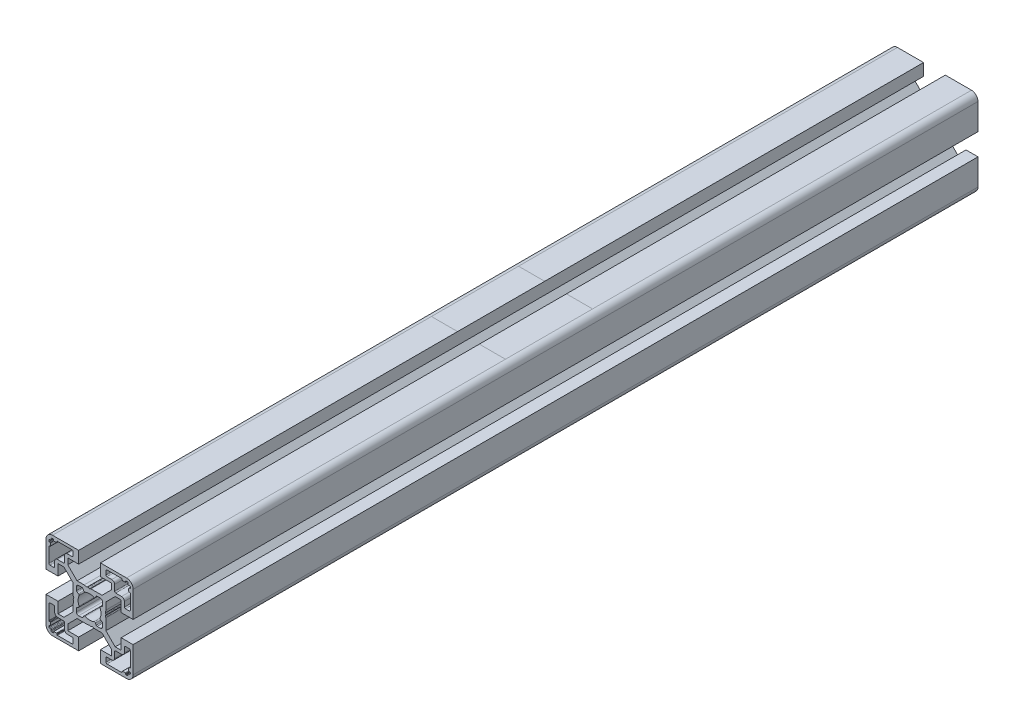
from build123d import *

# Parameters (mm, degrees)
BOSS_EXTRU_1_DEPTH = 388


with BuildPart() as part:
    # Esquisse1 → Boss.-Extru.1 (new body)
    with BuildSketch(Plane.XY.offset(50)):
        with BuildLine():
            Line((-12.564461466, 27.123082583), (-12.564461466, 15.123082583))
            Line((-12.564461466, 15.123082583), (-7.064461466, 15.123082583))
            Line((-7.064461466, 15.123082583), (-7.064461466, 20.123082583))
            Line((-7.064461466, 20.123082583), (-4.332228419, 20.123082583))
            Line((-4.332228419, 20.123082583), (-0.064461466, 15.85531563))
            Line((-0.064461466, 15.85531563), (-0.064461466, 10.776672421))
            ThreePointArc((-0.064461466, 10.776672421), (-0.047424379, 10.647262899), (0.002525832, 10.526672421))
            Line((0.002525832, 10.526672421), (0.235538534, 10.123082583))
            Line((0.235538534, 10.123082583), (0.002525832, 9.719492744))
            ThreePointArc((0.002525832, 9.719492744), (-0.064461466, 9.469492744), (0.002525832, 9.219492744))
            Line((0.002525832, 9.219492744), (0.184561942, 8.904196954))
            Line((0.184561942, 8.904196954), (-0.064461466, 7.623082583))
            Line((-0.064461466, 7.623082583), (-0.064461466, 4.390849536))
            Line((-0.064461466, 4.390849536), (-4.332228419, 0.123082583))
            Line((-4.332228419, 0.123082583), (-7.064461466, 0.123082583))
            Line((-7.064461466, 0.123082583), (-7.064461466, 5.123082583))
            Line((-7.064461466, 5.123082583), (-12.564461466, 5.123082583))
            Line((-12.564461466, 5.123082583), (-12.564461466, -6.876917417))
            ThreePointArc((-12.564461466, -6.876917417), (-11.685781809, -8.998237761), (-9.564461466, -9.876917417))
            Line((-9.564461466, -9.876917417), (2.435538534, -9.876917417))
            Line((2.435538534, -9.876917417), (2.435538534, -4.376917417))
            Line((2.435538534, -4.376917417), (-2.564461466, -4.376917417))
            Line((-2.564461466, -4.376917417), (-2.564461466, -1.64468437))
            Line((-2.564461466, -1.64468437), (1.703305487, 2.623082583))
            Line((1.703305487, 2.623082583), (6.781948696, 2.623082583))
            ThreePointArc((6.781948696, 2.623082583), (6.911358218, 2.640119669), (7.031948696, 2.690069881))
            Line((7.031948696, 2.690069881), (7.435538534, 2.923082583))
            Line((7.435538534, 2.923082583), (7.839128373, 2.690069881))
            ThreePointArc((7.839128373, 2.690069881), (8.089128373, 2.623082583), (8.339128373, 2.690069881))
            Line((8.339128373, 2.690069881), (8.654424163, 2.87210599))
            Line((8.654424163, 2.87210599), (9.935538534, 2.623082583))
            Line((9.935538534, 2.623082583), (13.167771581, 2.623082583))
            Line((13.167771581, 2.623082583), (17.435538534, -1.64468437))
            Line((17.435538534, -1.64468437), (17.435538534, -4.376917417))
            Line((17.435538534, -4.376917417), (12.435538534, -4.376917417))
            Line((12.435538534, -4.376917417), (12.435538534, -9.876917417))
            Line((12.435538534, -9.876917417), (24.435538534, -9.876917417))
            ThreePointArc((24.435538534, -9.876917417), (26.556858878, -8.998237761), (27.435538534, -6.876917417))
            Line((27.435538534, -6.876917417), (27.435538534, 5.123082583))
            Line((27.435538534, 5.123082583), (21.935538534, 5.123082583))
            Line((21.935538534, 5.123082583), (21.935538534, 0.123082583))
            Line((21.935538534, 0.123082583), (19.203305487, 0.123082583))
            Line((19.203305487, 0.123082583), (14.935538534, 4.390849536))
            Line((14.935538534, 4.390849536), (14.935538534, 9.469492744))
            ThreePointArc((14.935538534, 9.469492744), (14.918501447, 9.598902267), (14.868551236, 9.719492744))
            Line((14.868551236, 9.719492744), (14.635538534, 10.123082583))
            Line((14.635538534, 10.123082583), (14.868551236, 10.526672421))
            ThreePointArc((14.868551236, 10.526672421), (14.935538534, 10.776672421), (14.868551236, 11.026672421))
            Line((14.868551236, 11.026672421), (14.686515127, 11.341968211))
            Line((14.686515127, 11.341968211), (14.935538534, 12.623082583))
            Line((14.935538534, 12.623082583), (14.935538534, 15.85531563))
            Line((14.935538534, 15.85531563), (19.203305487, 20.123082583))
            Line((19.203305487, 20.123082583), (21.935538534, 20.123082583))
            Line((21.935538534, 20.123082583), (21.935538534, 15.123082583))
            Line((21.935538534, 15.123082583), (27.435538534, 15.123082583))
            Line((27.435538534, 15.123082583), (27.435538534, 27.123082583))
            ThreePointArc((27.435538534, 27.123082583), (26.556858878, 29.244402926), (24.435538534, 30.123082583))
            Line((24.435538534, 30.123082583), (12.435538534, 30.123082583))
            Line((12.435538534, 30.123082583), (12.435538534, 24.623082583))
            Line((12.435538534, 24.623082583), (17.435538534, 24.623082583))
            Line((17.435538534, 24.623082583), (17.435538534, 21.890849536))
            Line((17.435538534, 21.890849536), (13.167771581, 17.623082583))
            Line((13.167771581, 17.623082583), (8.089128373, 17.623082583))
            ThreePointArc((8.089128373, 17.623082583), (7.95971885, 17.606045496), (7.839128373, 17.556095285))
            Line((7.839128373, 17.556095285), (7.435538534, 17.323082583))
            Line((7.435538534, 17.323082583), (7.031948696, 17.556095285))
            ThreePointArc((7.031948696, 17.556095285), (6.781948696, 17.623082583), (6.531948696, 17.556095285))
            Line((6.531948696, 17.556095285), (6.216652905, 17.374059175))
            Line((6.216652905, 17.374059175), (4.935538534, 17.623082583))
            Line((4.935538534, 17.623082583), (1.703305487, 17.623082583))
            Line((1.703305487, 17.623082583), (-2.564461466, 21.890849536))
            Line((-2.564461466, 21.890849536), (-2.564461466, 24.623082583))
            Line((-2.564461466, 24.623082583), (2.435538534, 24.623082583))
            Line((2.435538534, 24.623082583), (2.435538534, 30.123082583))
            Line((2.435538534, 30.123082583), (-9.564461466, 30.123082583))
            ThreePointArc((-9.564461466, 30.123082583), (-11.685781809, 29.244402926), (-12.564461466, 27.123082583))
        make_face()
        with BuildLine():
            Line((-11.264461466, -4.676917417), (-11.264461466, 2.123082583))
            ThreePointArc((-11.264461466, 2.123082583), (-11.118014856, 2.476635973), (-10.764461466, 2.623082583))
            Line((-10.764461466, 2.623082583), (-9.064461466, 2.623082583))
            ThreePointArc((-9.064461466, 2.623082583), (-8.710908075, 2.476635973), (-8.564461466, 2.123082583))
            Line((-8.564461466, 2.123082583), (-8.564461466, -0.076917417))
            ThreePointArc((-8.564461466, -0.076917417), (-8.183700281, -0.996156233), (-7.264461466, -1.376917417))
            Line((-7.264461466, -1.376917417), (-4.564461466, -1.376917417))
            ThreePointArc((-4.564461466, -1.376917417), (-4.210908075, -1.523364027), (-4.064461466, -1.876917417))
            Line((-4.064461466, -1.876917417), (-4.064461466, -4.576917417))
            ThreePointArc((-4.064461466, -4.576917417), (-3.683700281, -5.496156233), (-2.764461466, -5.876917417))
            Line((-2.764461466, -5.876917417), (-0.564461466, -5.876917417))
            ThreePointArc((-0.564461466, -5.876917417), (-0.210908075, -6.023364027), (-0.064461466, -6.376917417))
            Line((-0.064461466, -6.376917417), (-0.064461466, -8.076917417))
            ThreePointArc((-0.064461466, -8.076917417), (-0.210908075, -8.430470808), (-0.564461466, -8.576917417))
            Line((-0.564461466, -8.576917417), (-7.364461466, -8.576917417))
            ThreePointArc((-7.364461466, -8.576917417), (-7.505882822, -8.518338774), (-7.564461466, -8.376917417))
            Line((-7.564461466, -8.376917417), (-7.564461466, -8.076917417))
            ThreePointArc((-7.564461466, -8.076917417), (-7.62304011, -7.935496061), (-7.764461466, -7.876917417))
            Line((-7.764461466, -7.876917417), (-8.964461466, -7.876917417))
            ThreePointArc((-8.964461466, -7.876917417), (-9.105882822, -7.935496061), (-9.164461466, -8.076917417))
            Line((-9.164461466, -8.076917417), (-9.164461466, -8.376917417))
            ThreePointArc((-9.164461466, -8.376917417), (-9.22304011, -8.518338774), (-9.364461466, -8.576917417))
            Line((-9.364461466, -8.576917417), (-9.864461466, -8.576917417))
            ThreePointArc((-9.864461466, -8.576917417), (-10.0765935, -8.489049452), (-10.164461466, -8.276917417))
            Line((-10.164461466, -8.276917417), (-10.164461466, -7.776917417))
            ThreePointArc((-10.164461466, -7.776917417), (-10.252329431, -7.564785383), (-10.464461466, -7.476917417))
            Line((-10.464461466, -7.476917417), (-10.964461466, -7.476917417))
            ThreePointArc((-10.964461466, -7.476917417), (-11.1765935, -7.389049452), (-11.264461466, -7.176917417))
            Line((-11.264461466, -7.176917417), (-11.264461466, -6.676917417))
            ThreePointArc((-11.264461466, -6.676917417), (-11.205882822, -6.535496061), (-11.064461466, -6.476917417))
            Line((-11.064461466, -6.476917417), (-10.764461466, -6.476917417))
            ThreePointArc((-10.764461466, -6.476917417), (-10.62304011, -6.418338774), (-10.564461466, -6.276917417))
            Line((-10.564461466, -6.276917417), (-10.564461466, -5.076917417))
            ThreePointArc((-10.564461466, -5.076917417), (-10.62304011, -4.935496061), (-10.764461466, -4.876917417))
            Line((-10.764461466, -4.876917417), (-11.064461466, -4.876917417))
            ThreePointArc((-11.064461466, -4.876917417), (-11.205882822, -4.818338774), (-11.264461466, -4.676917417))
        make_face(mode=Mode.SUBTRACT)
        with BuildLine():
            Line((14.935538534, -8.076917417), (14.935538534, -6.376917417))
            ThreePointArc((14.935538534, -6.376917417), (15.081985144, -6.023364027), (15.435538534, -5.876917417))
            Line((15.435538534, -5.876917417), (17.635538534, -5.876917417))
            ThreePointArc((17.635538534, -5.876917417), (18.55477735, -5.496156233), (18.935538534, -4.576917417))
            Line((18.935538534, -4.576917417), (18.935538534, -1.876917417))
            ThreePointArc((18.935538534, -1.876917417), (19.081985144, -1.523364027), (19.435538534, -1.376917417))
            Line((19.435538534, -1.376917417), (22.135538534, -1.376917417))
            ThreePointArc((22.135538534, -1.376917417), (23.05477735, -0.996156233), (23.435538534, -0.076917417))
            Line((23.435538534, -0.076917417), (23.435538534, 2.123082583))
            ThreePointArc((23.435538534, 2.123082583), (23.581985144, 2.476635973), (23.935538534, 2.623082583))
            Line((23.935538534, 2.623082583), (25.635538534, 2.623082583))
            ThreePointArc((25.635538534, 2.623082583), (25.989091925, 2.476635973), (26.135538534, 2.123082583))
            Line((26.135538534, 2.123082583), (26.135538534, -4.676917417))
            ThreePointArc((26.135538534, -4.676917417), (26.07695989, -4.818338774), (25.935538534, -4.876917417))
            Line((25.935538534, -4.876917417), (25.635538534, -4.876917417))
            ThreePointArc((25.635538534, -4.876917417), (25.494117178, -4.935496061), (25.435538534, -5.076917417))
            Line((25.435538534, -5.076917417), (25.435538534, -6.276917417))
            ThreePointArc((25.435538534, -6.276917417), (25.494117178, -6.418338774), (25.635538534, -6.476917417))
            Line((25.635538534, -6.476917417), (25.935538534, -6.476917417))
            ThreePointArc((25.935538534, -6.476917417), (26.07695989, -6.535496061), (26.135538534, -6.676917417))
            Line((26.135538534, -6.676917417), (26.135538534, -7.176917417))
            ThreePointArc((26.135538534, -7.176917417), (26.047670569, -7.389049452), (25.835538534, -7.476917417))
            Line((25.835538534, -7.476917417), (25.335538534, -7.476917417))
            ThreePointArc((25.335538534, -7.476917417), (25.1234065, -7.564785383), (25.035538534, -7.776917417))
            Line((25.035538534, -7.776917417), (25.035538534, -8.276917417))
            ThreePointArc((25.035538534, -8.276917417), (24.947670569, -8.489049452), (24.735538534, -8.576917417))
            Line((24.735538534, -8.576917417), (24.235538534, -8.576917417))
            ThreePointArc((24.235538534, -8.576917417), (24.094117178, -8.518338774), (24.035538534, -8.376917417))
            Line((24.035538534, -8.376917417), (24.035538534, -8.076917417))
            ThreePointArc((24.035538534, -8.076917417), (23.97695989, -7.935496061), (23.835538534, -7.876917417))
            Line((23.835538534, -7.876917417), (22.635538534, -7.876917417))
            ThreePointArc((22.635538534, -7.876917417), (22.494117178, -7.935496061), (22.435538534, -8.076917417))
            Line((22.435538534, -8.076917417), (22.435538534, -8.376917417))
            ThreePointArc((22.435538534, -8.376917417), (22.37695989, -8.518338774), (22.235538534, -8.576917417))
            Line((22.235538534, -8.576917417), (15.435538534, -8.576917417))
            ThreePointArc((15.435538534, -8.576917417), (15.081985144, -8.430470808), (14.935538534, -8.076917417))
        make_face(mode=Mode.SUBTRACT)
        with BuildLine():
            Line((14.935538534, 26.623082583), (14.935538534, 28.323082583))
            ThreePointArc((14.935538534, 28.323082583), (15.081985144, 28.676635973), (15.435538534, 28.823082583))
            Line((15.435538534, 28.823082583), (22.235538534, 28.823082583))
            ThreePointArc((22.235538534, 28.823082583), (22.37695989, 28.764503939), (22.435538534, 28.623082583))
            Line((22.435538534, 28.623082583), (22.435538534, 28.323082583))
            ThreePointArc((22.435538534, 28.323082583), (22.494117178, 28.181661226), (22.635538534, 28.123082583))
            Line((22.635538534, 28.123082583), (23.835538534, 28.123082583))
            ThreePointArc((23.835538534, 28.123082583), (23.97695989, 28.181661226), (24.035538534, 28.323082583))
            Line((24.035538534, 28.323082583), (24.035538534, 28.623082583))
            ThreePointArc((24.035538534, 28.623082583), (24.094117178, 28.764503939), (24.235538534, 28.823082583))
            Line((24.235538534, 28.823082583), (24.735538534, 28.823082583))
            ThreePointArc((24.735538534, 28.823082583), (24.947670569, 28.735214617), (25.035538534, 28.523082583))
            Line((25.035538534, 28.523082583), (25.035538534, 28.023082583))
            ThreePointArc((25.035538534, 28.023082583), (25.1234065, 27.810950548), (25.335538534, 27.723082583))
            Line((25.335538534, 27.723082583), (25.835538534, 27.723082583))
            ThreePointArc((25.835538534, 27.723082583), (26.047670569, 27.635214617), (26.135538534, 27.423082583))
            Line((26.135538534, 27.423082583), (26.135538534, 26.923082583))
            ThreePointArc((26.135538534, 26.923082583), (26.07695989, 26.781661226), (25.935538534, 26.723082583))
            Line((25.935538534, 26.723082583), (25.635538534, 26.723082583))
            ThreePointArc((25.635538534, 26.723082583), (25.494117178, 26.664503939), (25.435538534, 26.523082583))
            Line((25.435538534, 26.523082583), (25.435538534, 25.323082583))
            ThreePointArc((25.435538534, 25.323082583), (25.494117178, 25.181661226), (25.635538534, 25.123082583))
            Line((25.635538534, 25.123082583), (25.935538534, 25.123082583))
            ThreePointArc((25.935538534, 25.123082583), (26.07695989, 25.064503939), (26.135538534, 24.923082583))
            Line((26.135538534, 24.923082583), (26.135538534, 18.123082583))
            ThreePointArc((26.135538534, 18.123082583), (25.989091925, 17.769529192), (25.635538534, 17.623082583))
            Line((25.635538534, 17.623082583), (23.935538534, 17.623082583))
            ThreePointArc((23.935538534, 17.623082583), (23.581985144, 17.769529192), (23.435538534, 18.123082583))
            Line((23.435538534, 18.123082583), (23.435538534, 20.323082583))
            ThreePointArc((23.435538534, 20.323082583), (23.05477735, 21.242321398), (22.135538534, 21.623082583))
            Line((22.135538534, 21.623082583), (19.435538534, 21.623082583))
            ThreePointArc((19.435538534, 21.623082583), (19.081985144, 21.769529192), (18.935538534, 22.123082583))
            Line((18.935538534, 22.123082583), (18.935538534, 24.823082583))
            ThreePointArc((18.935538534, 24.823082583), (18.55477735, 25.742321398), (17.635538534, 26.123082583))
            Line((17.635538534, 26.123082583), (15.435538534, 26.123082583))
            ThreePointArc((15.435538534, 26.123082583), (15.081985144, 26.269529192), (14.935538534, 26.623082583))
        make_face(mode=Mode.SUBTRACT)
        with BuildLine():
            Line((-11.264461466, 18.123082583), (-11.264461466, 24.923082583))
            ThreePointArc((-11.264461466, 24.923082583), (-11.205882822, 25.064503939), (-11.064461466, 25.123082583))
            Line((-11.064461466, 25.123082583), (-10.764461466, 25.123082583))
            ThreePointArc((-10.764461466, 25.123082583), (-10.62304011, 25.181661226), (-10.564461466, 25.323082583))
            Line((-10.564461466, 25.323082583), (-10.564461466, 26.523082583))
            ThreePointArc((-10.564461466, 26.523082583), (-10.62304011, 26.664503939), (-10.764461466, 26.723082583))
            Line((-10.764461466, 26.723082583), (-11.064461466, 26.723082583))
            ThreePointArc((-11.064461466, 26.723082583), (-11.205882822, 26.781661226), (-11.264461466, 26.923082583))
            Line((-11.264461466, 26.923082583), (-11.264461466, 27.423082583))
            ThreePointArc((-11.264461466, 27.423082583), (-11.1765935, 27.635214617), (-10.964461466, 27.723082583))
            Line((-10.964461466, 27.723082583), (-10.464461466, 27.723082583))
            ThreePointArc((-10.464461466, 27.723082583), (-10.252329431, 27.810950548), (-10.164461466, 28.023082583))
            Line((-10.164461466, 28.023082583), (-10.164461466, 28.523082583))
            ThreePointArc((-10.164461466, 28.523082583), (-10.0765935, 28.735214617), (-9.864461466, 28.823082583))
            Line((-9.864461466, 28.823082583), (-9.364461466, 28.823082583))
            ThreePointArc((-9.364461466, 28.823082583), (-9.22304011, 28.764503939), (-9.164461466, 28.623082583))
            Line((-9.164461466, 28.623082583), (-9.164461466, 28.323082583))
            ThreePointArc((-9.164461466, 28.323082583), (-9.105882822, 28.181661226), (-8.964461466, 28.123082583))
            Line((-8.964461466, 28.123082583), (-7.764461466, 28.123082583))
            ThreePointArc((-7.764461466, 28.123082583), (-7.62304011, 28.181661226), (-7.564461466, 28.323082583))
            Line((-7.564461466, 28.323082583), (-7.564461466, 28.623082583))
            ThreePointArc((-7.564461466, 28.623082583), (-7.505882822, 28.764503939), (-7.364461466, 28.823082583))
            Line((-7.364461466, 28.823082583), (-0.564461466, 28.823082583))
            ThreePointArc((-0.564461466, 28.823082583), (-0.210908075, 28.676635973), (-0.064461466, 28.323082583))
            Line((-0.064461466, 28.323082583), (-0.064461466, 26.623082583))
            ThreePointArc((-0.064461466, 26.623082583), (-0.210908075, 26.269529192), (-0.564461466, 26.123082583))
            Line((-0.564461466, 26.123082583), (-2.764461466, 26.123082583))
            ThreePointArc((-2.764461466, 26.123082583), (-3.683700281, 25.742321398), (-4.064461466, 24.823082583))
            Line((-4.064461466, 24.823082583), (-4.064461466, 22.123082583))
            ThreePointArc((-4.064461466, 22.123082583), (-4.210908075, 21.769529192), (-4.564461466, 21.623082583))
            Line((-4.564461466, 21.623082583), (-7.264461466, 21.623082583))
            ThreePointArc((-7.264461466, 21.623082583), (-8.183700281, 21.242321398), (-8.564461466, 20.323082583))
            Line((-8.564461466, 20.323082583), (-8.564461466, 18.123082583))
            ThreePointArc((-8.564461466, 18.123082583), (-8.710908075, 17.769529192), (-9.064461466, 17.623082583))
            Line((-9.064461466, 17.623082583), (-10.764461466, 17.623082583))
            ThreePointArc((-10.764461466, 17.623082583), (-11.118014856, 17.769529192), (-11.264461466, 18.123082583))
        make_face(mode=Mode.SUBTRACT)
        with BuildLine():
            Line((10.926225434, 16.123082583), (12.435538534, 16.123082583))
            ThreePointArc((12.435538534, 16.123082583), (13.142645315, 15.830189364), (13.435538534, 15.123082583))
            Line((13.435538534, 15.123082583), (13.435538534, 13.613769482))
            ThreePointArc((13.435538534, 13.613769482), (13.364122185, 13.356250445), (13.170274316, 13.172295686))
            Line((13.170274316, 13.172295686), (12.493256258, 12.812318799))
            ThreePointArc((12.493256258, 12.812318799), (12.256654607, 12.537701304), (12.267778691, 12.175387401))
            ThreePointArc((12.267778691, 12.175387401), (12.685538534, 10.123082583), (12.267778691, 8.070777764))
            ThreePointArc((12.267778691, 8.070777764), (12.256654607, 7.708463861), (12.493256258, 7.433846366))
            Line((12.493256258, 7.433846366), (13.170274316, 7.07386948))
            ThreePointArc((13.170274316, 7.07386948), (13.364122185, 6.889914721), (13.435538534, 6.632395683))
            Line((13.435538534, 6.632395683), (13.435538534, 5.123082583))
            ThreePointArc((13.435538534, 5.123082583), (13.142645315, 4.415975801), (12.435538534, 4.123082583))
            Line((12.435538534, 4.123082583), (10.926225434, 4.123082583))
            ThreePointArc((10.926225434, 4.123082583), (10.668706396, 4.194498932), (10.484751637, 4.388346801))
            Line((10.484751637, 4.388346801), (10.124774751, 5.065364859))
            ThreePointArc((10.124774751, 5.065364859), (9.850157255, 5.301966509), (9.487843352, 5.290842426))
            ThreePointArc((9.487843352, 5.290842426), (7.435538534, 4.873082583), (5.383233716, 5.290842426))
            ThreePointArc((5.383233716, 5.290842426), (5.020919813, 5.301966509), (4.746302318, 5.065364859))
            Line((4.746302318, 5.065364859), (4.386325431, 4.388346801))
            ThreePointArc((4.386325431, 4.388346801), (4.202370672, 4.194498932), (3.944851635, 4.123082583))
            Line((3.944851635, 4.123082583), (2.435538534, 4.123082583))
            ThreePointArc((2.435538534, 4.123082583), (1.728431753, 4.415975801), (1.435538534, 5.123082583))
            Line((1.435538534, 5.123082583), (1.435538534, 6.632395683))
            ThreePointArc((1.435538534, 6.632395683), (1.506954884, 6.889914721), (1.700802753, 7.07386948))
            Line((1.700802753, 7.07386948), (2.37782081, 7.433846366))
            ThreePointArc((2.37782081, 7.433846366), (2.614422461, 7.708463861), (2.603298377, 8.070777764))
            ThreePointArc((2.603298377, 8.070777764), (2.185538534, 10.123082583), (2.603298377, 12.175387401))
            ThreePointArc((2.603298377, 12.175387401), (2.614422461, 12.537701304), (2.37782081, 12.812318799))
            Line((2.37782081, 12.812318799), (1.700802753, 13.172295686))
            ThreePointArc((1.700802753, 13.172295686), (1.506954884, 13.356250445), (1.435538534, 13.613769482))
            Line((1.435538534, 13.613769482), (1.435538534, 15.123082583))
            ThreePointArc((1.435538534, 15.123082583), (1.728431753, 15.830189364), (2.435538534, 16.123082583))
            Line((2.435538534, 16.123082583), (3.944851635, 16.123082583))
            ThreePointArc((3.944851635, 16.123082583), (4.202370672, 16.051666233), (4.386325431, 15.857818364))
            Line((4.386325431, 15.857818364), (4.746302318, 15.180800306))
            ThreePointArc((4.746302318, 15.180800306), (5.020919813, 14.944198656), (5.383233716, 14.955322739))
            ThreePointArc((5.383233716, 14.955322739), (7.435538534, 15.373082583), (9.487843352, 14.955322739))
            ThreePointArc((9.487843352, 14.955322739), (9.850157255, 14.944198656), (10.124774751, 15.180800306))
            Line((10.124774751, 15.180800306), (10.484751637, 15.857818364))
            ThreePointArc((10.484751637, 15.857818364), (10.668706396, 16.051666233), (10.926225434, 16.123082583))
        make_face(mode=Mode.SUBTRACT)
    extrude(amount=-BOSS_EXTRU_1_DEPTH)


solid = part.part
